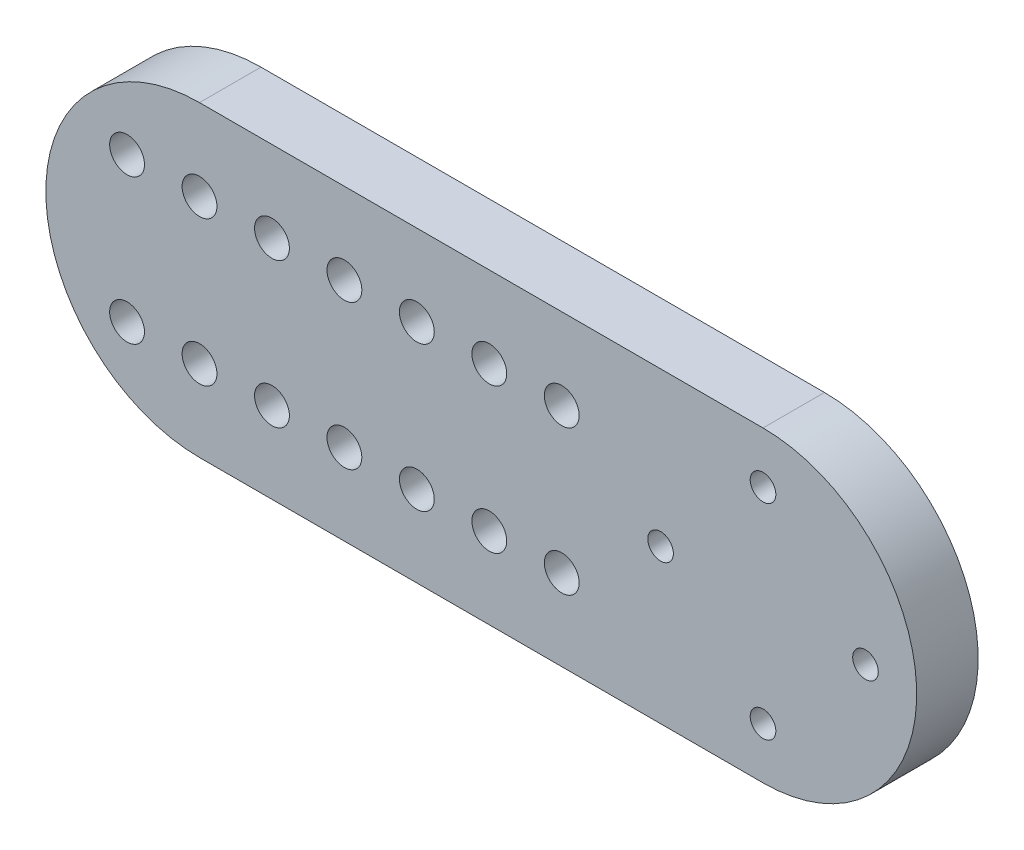
from build123d import *

# Parameters (mm, degrees)
EXTRUDE_1_DEPTH   = 6
M3X0_51_D         = 2.5
HOLE_WIZARD_M31_D = 3.4


with BuildPart() as part:
    # Эскиз1 → Бобышка-Вытянуть1 (new body)
    with BuildSketch(Plane.XY):
        with BuildLine():
            Line((-27.5, 15), (27.5, 15))
            ThreePointArc((27.5, 15), (42.5, 0), (27.5, -15))
            Line((27.5, -15), (-27.5, -15))
            ThreePointArc((-27.5, -15), (-42.5, 0), (-27.5, 15))
        make_face()
    extrude(amount=EXTRUDE_1_DEPTH)

    # Отверстие обработанное метчиком M3x0.51 (through all)
    with Locations(Plane.XY.offset(6)):
        with Locations((27.5, 10), (37.5, 0), (27.5, -10), (17.5, 0)):
            Hole(M3X0_51_D / 2)

    # Отверстие с зазором M31 (through all)
    with Locations(Plane.XY.offset(6)):
        with Locations((-34.571067812, 7.071067812), (-20.428932188, 7.071067812), (-6.286796564, 7.071067812), (7.855339059, 7.071067812), (7.855339059, -7.071067812), (-6.286796564, -7.071067812), (-20.428932188, -7.071067812), (-34.571067812, -7.071067812), (-27.5, -7.071067812), (-27.5, 7.071067812), (-13.357864376, 7.071067812), (-13.357864376, -7.071067812), (0.784271247, -7.071067812), (0.784271247, 7.071067812)):
            Hole(HOLE_WIZARD_M31_D / 2)


solid = part.part
